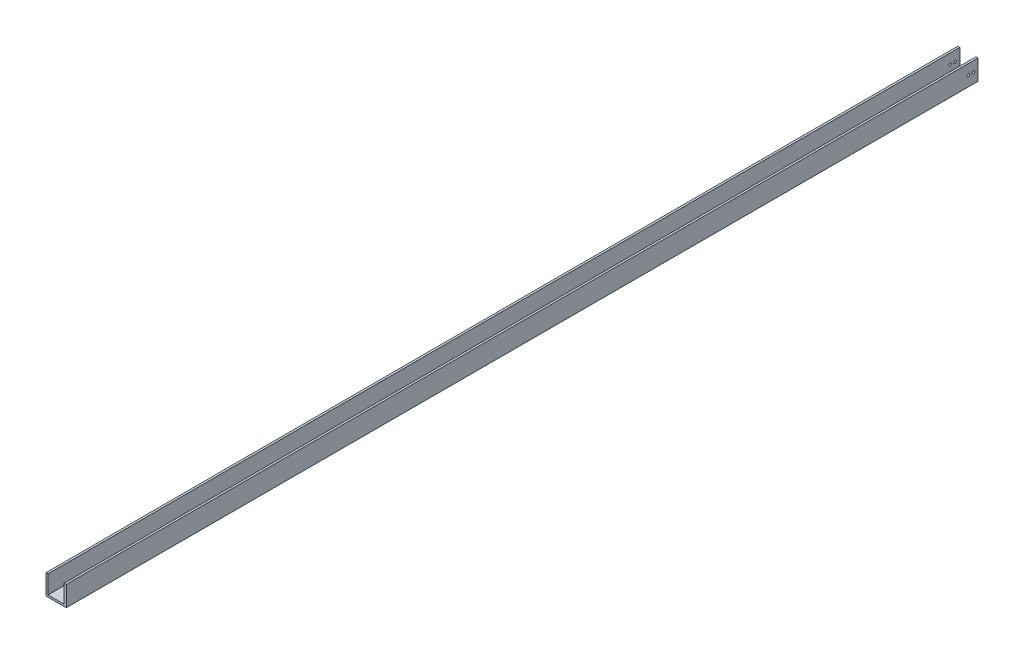
from build123d import *

# Parameters (mm, degrees)
SALIENTE_EXTRUIR1_DEPTH = 1800
CROQUIS2_R              = 2.5
CORTAR_EXTRUIR1_DEPTH   = 1801.888669518
CROQUIS3_R              = 2.5
CORTAR_EXTRUIR2_DEPTH   = 10


with BuildPart() as part:
    # Croquis1 → Saliente-Extruir1 (new body)
    with BuildSketch(Plane.XY):
        Polygon((0, 0), (4, 0), (4, -36), (36, -36), (36, 0), (40, 0), (40, -40), (0, -40), align=None)
    extrude(amount=SALIENTE_EXTRUIR1_DEPTH)

    # Croquis2 → Cortar-Extruir1 (cut, through all)
    with BuildSketch(Plane.ZY):
        with Locations((9, -20)):
            Circle(CROQUIS2_R)
        with Locations((19, -20)):
            Circle(CROQUIS2_R)
    extrude(amount=-CORTAR_EXTRUIR1_DEPTH, mode=Mode.SUBTRACT)

    # Croquis3 → Cortar-Extruir2 (cut)
    with BuildSketch(Plane(origin=(0, -40, 0), x_dir=(-1, 0, 0), z_dir=(0, -1, 0))):
        with Locations(Location((-20, -9, 0), (0, 0, 180))):
            Circle(CROQUIS3_R)
        with Locations(Location((-20, -19, 0), (0, 0, 180))):
            Circle(CROQUIS3_R)
    extrude(amount=-CORTAR_EXTRUIR2_DEPTH, mode=Mode.SUBTRACT)


solid = part.part
